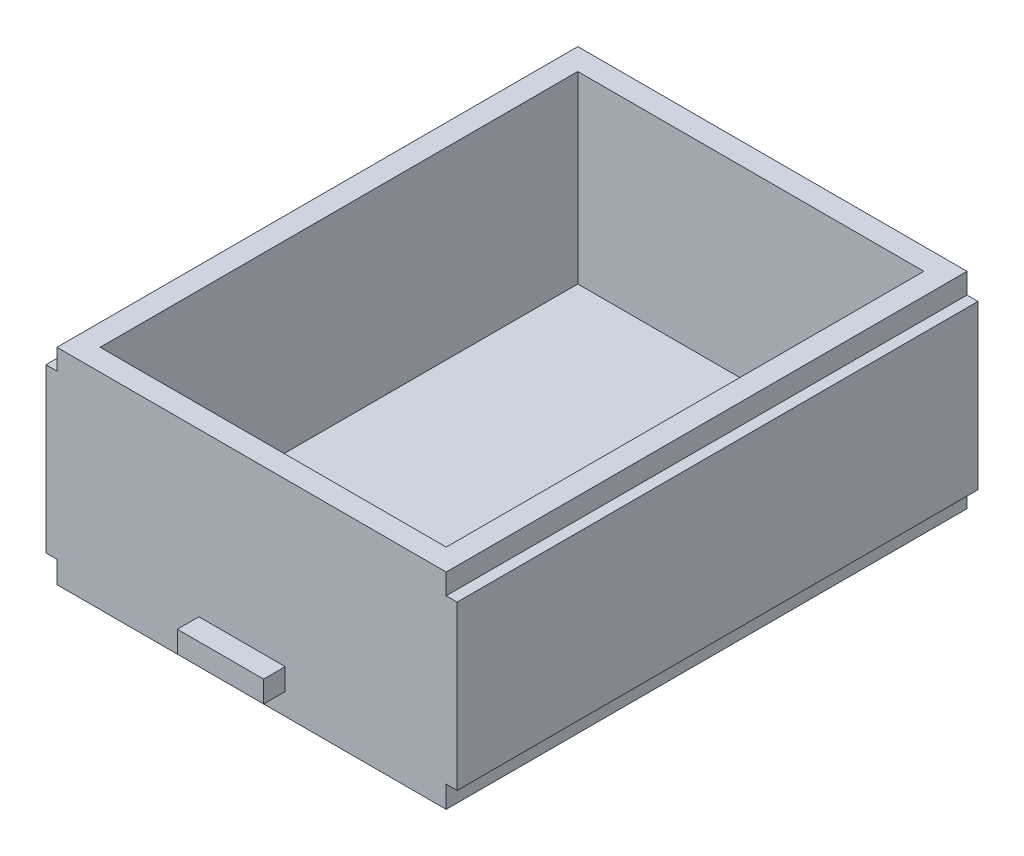
from build123d import *

# Parameters (mm, degrees)
CROQUIS1_W              = 72.136
CROQUIS1_H              = 38.1
SALIENTE_EXTRUIR1_DEPTH = 96.52
VACIADO1_T              = -4
CROQUIS2_W              = 2.032
CROQUIS2_H              = 30.226
SALIENTE_EXTRUIR2_DEPTH = 96.52
CROQUIS3_W              = 16
CROQUIS3_H              = 4
SALIENTE_EXTRUIR3_DEPTH = 4


with BuildPart() as part:
    # Croquis1 → Saliente-Extruir1 (new body)
    with BuildSketch(Plane.XY):
        Rectangle(CROQUIS1_W, CROQUIS1_H)
    extrude(amount=SALIENTE_EXTRUIR1_DEPTH)

    # Vaciado1
    vaciado1_openings = [part.faces().sort_by_distance(p)[0] for p in [
        (0, 19.05, 48.26),
    ]]
    offset(amount=VACIADO1_T, openings=vaciado1_openings, kind=Kind.INTERSECTION)

    # Croquis2 → Saliente-Extruir2 (add)
    with BuildSketch(Plane.XY.offset(96.52)):
        with Locations((-37.084, 0.127)):
            Rectangle(CROQUIS2_W, CROQUIS2_H)
        with Locations((37.084, 0.127)):
            Rectangle(CROQUIS2_W, CROQUIS2_H)
    extrude(amount=-SALIENTE_EXTRUIR2_DEPTH)

    # Croquis3 → Saliente-Extruir3 (add)
    with BuildSketch(Plane.XY.offset(96.52)):
        with Locations((-1.770271924, -13.05)):
            Rectangle(CROQUIS3_W, CROQUIS3_H)
    extrude(amount=SALIENTE_EXTRUIR3_DEPTH)


solid = part.part
